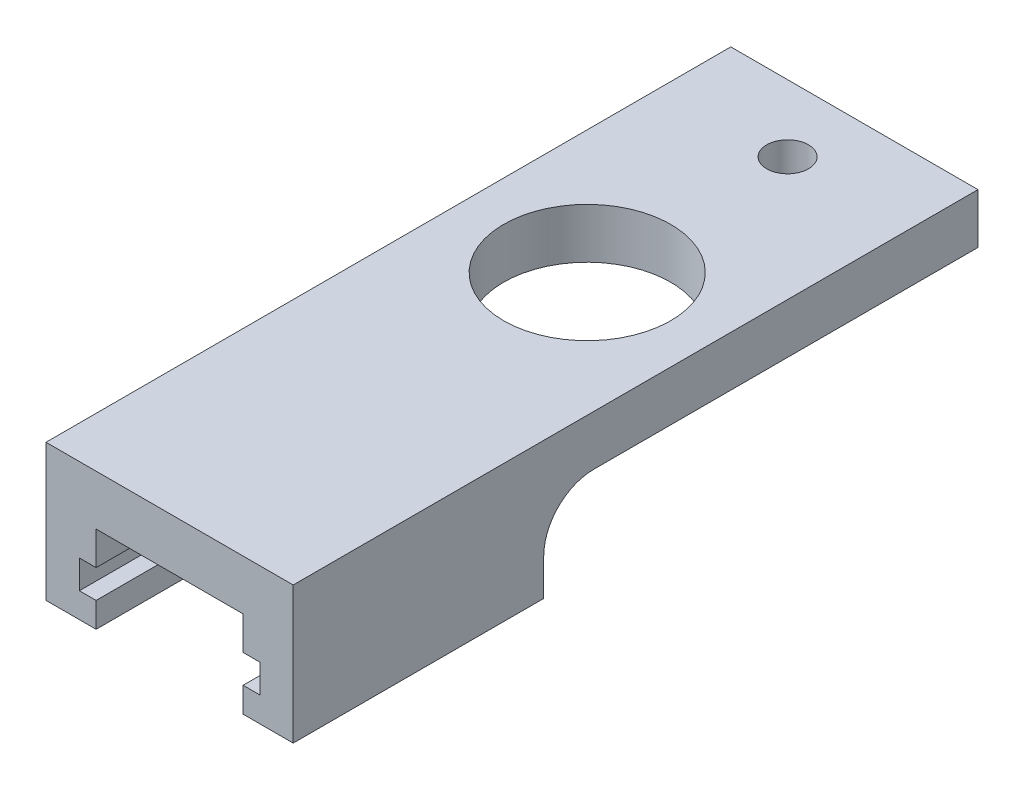
from build123d import *

# Parameters (mm, degrees)
SKETCH1_W                 = 14.8
SKETCH1_H                 = 15
BOSS_EXTRUDE1_DEPTH       = 8.2
SKETCH3_W                 = 8.8
SKETCH3_H                 = 5.2
CUT_EXTRUDE1_DEPTH        = 12
SKETCH5_W                 = 10.8
SKETCH5_H                 = 1.7
CUT_EXTRUDE2_DEPTH        = 12
SKETCH6_W                 = 14.8
SKETCH6_H                 = 3
BOSS_EXTRUDE2_DEPTH       = 26
SKETCH7_R                 = 5
CUT_EXTRUDE3_DEPTH        = 36.273928049
M3X0_5_TAPPED_HOLE1_D     = 2.5
M3X0_5_TAPPED_HOLE1_DEPTH = 7.5
M3X0_5_TAPPED_HOLE1_TIP   = 0.751075774
FILLET1_R                 = 3


with BuildPart() as part:
    # Sketch1 → Boss-Extrude1 (new body)
    with BuildSketch(Plane(origin=(0, 0, 0), x_dir=(1, 0, 0), z_dir=(0, 1, 0))):
        Rectangle(SKETCH1_W, SKETCH1_H)
    extrude(amount=BOSS_EXTRUDE1_DEPTH)

    # Sketch3 → Cut-Extrude1 (cut)
    with BuildSketch(Plane.XY.offset(7.5)):
        with Locations((0, 2.6)):
            Rectangle(SKETCH3_W, SKETCH3_H)
    extrude(amount=-CUT_EXTRUDE1_DEPTH, mode=Mode.SUBTRACT)

    # Sketch5 → Cut-Extrude2 (cut)
    with BuildSketch(Plane.XY.offset(7.5)):
        with Locations((0, 2.35)):
            Rectangle(SKETCH5_W, SKETCH5_H)
    extrude(amount=-CUT_EXTRUDE2_DEPTH, mode=Mode.SUBTRACT)

    # Sketch6 → Boss-Extrude2 (add)
    with BuildSketch(Plane(origin=(0, 0, -7.5), x_dir=(-1, 0, 0), z_dir=(0, 0, -1))):
        with Locations((0, 6.7)):
            Rectangle(SKETCH6_W, SKETCH6_H)
    extrude(amount=BOSS_EXTRUDE2_DEPTH)

    # Sketch7 → Cut-Extrude3 (cut, through all)
    with BuildSketch(Plane(origin=(0, 8.2, 0), x_dir=(1, 0, 0), z_dir=(0, 1, 0))):
        with Locations(Location((0, 17.5, 0), (0, 0, 270))):
            Circle(SKETCH7_R)
    extrude(amount=-CUT_EXTRUDE3_DEPTH, mode=Mode.SUBTRACT)

    # M3x0.5 Tapped Hole1
    with Locations(Plane(origin=(0, 8.2, 0), x_dir=(1, 0, 0), z_dir=(0, 1, 0))):
        with Locations((0, 29.5)):
            Hole(M3X0_5_TAPPED_HOLE1_D / 2, depth=M3X0_5_TAPPED_HOLE1_DEPTH)
            with Locations((0, 0, -(M3X0_5_TAPPED_HOLE1_DEPTH + M3X0_5_TAPPED_HOLE1_TIP / 2))):  # 118° drill point
                Cone(0, M3X0_5_TAPPED_HOLE1_D / 2, M3X0_5_TAPPED_HOLE1_TIP, mode=Mode.SUBTRACT)

    # Fillet1
    fillet1_edges = [part.edges().sort_by_distance(p)[0] for p in [
        (0, 5.2, -7.5),
    ]]
    fillet(fillet1_edges, radius=FILLET1_R)


solid = part.part
